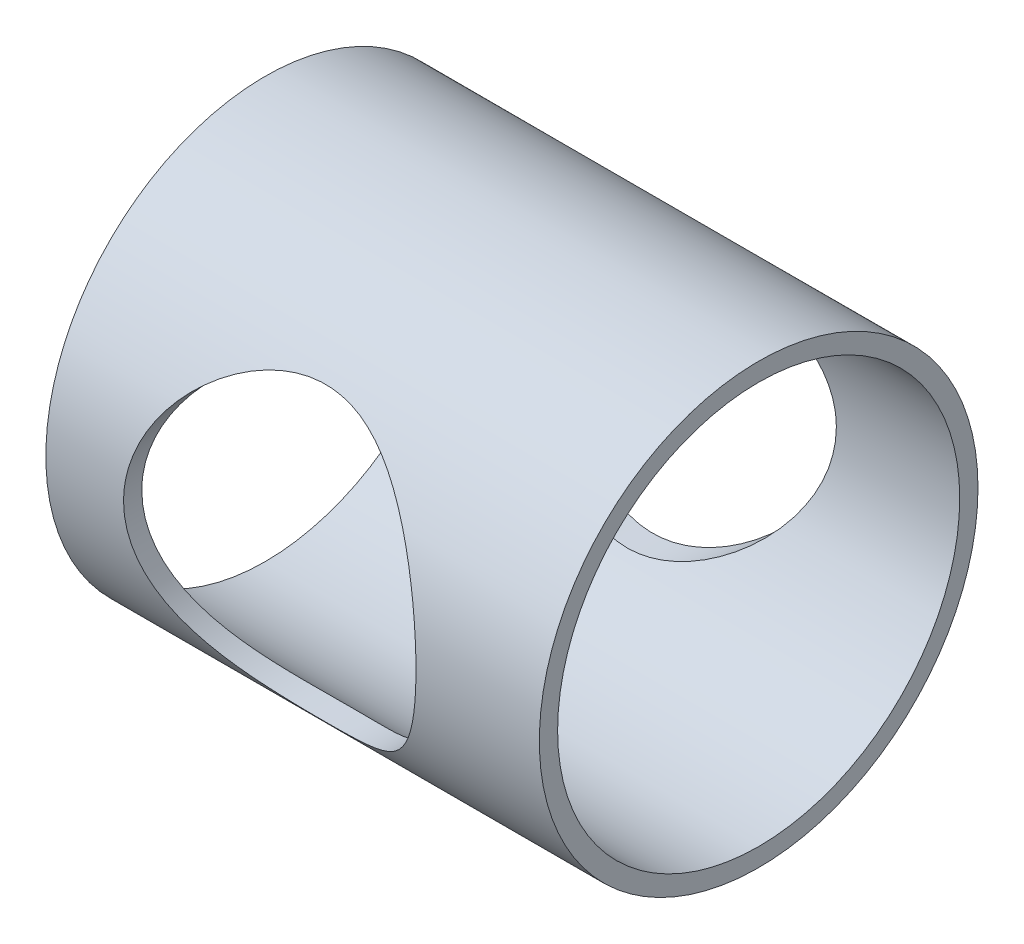
from build123d import *

# Parameters (mm, degrees)
SKETCH1_R               = 38.1
BOSS_EXTRUDE1_DEPTH     = 42.8625
SHELL1_T                = -3.175
CUT_EXTRUDE1_DEPTH      = 69.850663804
CUT_EXTRUDE1_DEPTH_BACK = 69.850663804
SKETCH2_R               = 25.4


with BuildPart() as part:
    # Sketch1 → Boss-Extrude1 (new, symmetric)
    with BuildSketch(Plane(origin=(0, 0, 0), x_dir=(0, 0, -1), z_dir=(1, 0, 0))):
        Circle(SKETCH1_R)
    extrude(amount=BOSS_EXTRUDE1_DEPTH, both=True)

    # Shell1
    shell1_openings = [part.faces().sort_by_distance(p)[0] for p in [
        (42.8625, 0, 0),
        (-42.8625, 0, 0),
    ]]
    offset(amount=SHELL1_T, openings=shell1_openings, kind=Kind.INTERSECTION)

    # Sketch2 → Cut-Extrude1 (cut, two sides: drawn at the far end of the back side and taken through both)
    with BuildSketch(Plane.XY.offset(-CUT_EXTRUDE1_DEPTH_BACK)):
        with Locations(Location((-3.96875, 0, 0), (0, 0, 180))):
            Circle(SKETCH2_R)
    extrude(amount=CUT_EXTRUDE1_DEPTH + CUT_EXTRUDE1_DEPTH_BACK, mode=Mode.SUBTRACT)


solid = part.part
